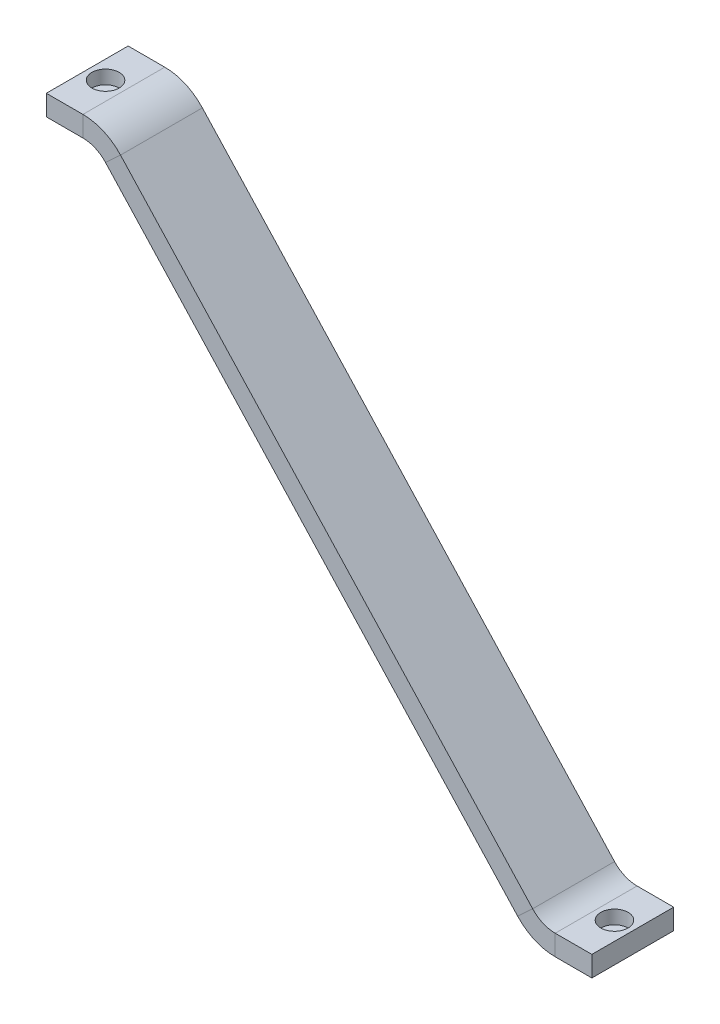
from build123d import *

# Parameters (mm, degrees)
SKETCH_2_W          = 60
SKETCH_2_H          = 15
SKETCH_3_R          = 10
CUT_EXTRUDE_1_DEPTH = 10
SKETCH_4_R          = 10
CUT_EXTRUDE_2_DEPTH = 10


with BuildPart() as part:
    # 扫描1: sweep along a path in 草图1
    with BuildLine(Plane.XY) as sweep_1_path:
        Line((0, 0), (26.862133413, 0))
        ThreePointArc((26.862133413, 0), (38.896590134, -2.519609693), (48.909571267, -9.655209904))
        Line((48.909571267, -9.655209904), (351.090428733, -337.125468596))
        ThreePointArc((351.090428733, -337.125468596), (361.103409866, -344.261068807), (373.137866587, -346.7806785))
        Line((373.137866587, -346.7806785), (400, -346.7806785))
    # 草图2 → 扫描1 (sweep)
    with BuildSketch(Plane(origin=(0, 0, 0), x_dir=(0, 0, -1), z_dir=(1, 0, 0))):
        Rectangle(SKETCH_2_W, SKETCH_2_H)
    sweep(path=sweep_1_path.line)

    # 草图3 → 切除-拉伸1 (cut)
    with BuildSketch(Plane(origin=(0, 7.5, 0), x_dir=(1, 0, 0), z_dir=(0, 1, 0))):
        with Locations(Location((13.431066706, 0, 0), (0, 0, 270))):
            Circle(SKETCH_3_R)
    extrude(amount=-CUT_EXTRUDE_1_DEPTH, mode=Mode.SUBTRACT)

    # 草图4 → 切除-拉伸2 (cut)
    with BuildSketch(Plane(origin=(0, -339.2806785, 0), x_dir=(1, 0, 0), z_dir=(0, 1, 0))):
        with Locations(Location((386.568933294, 0, 0), (0, 0, 180))):
            Circle(SKETCH_4_R)
    extrude(amount=-CUT_EXTRUDE_2_DEPTH, mode=Mode.SUBTRACT)


solid = part.part
